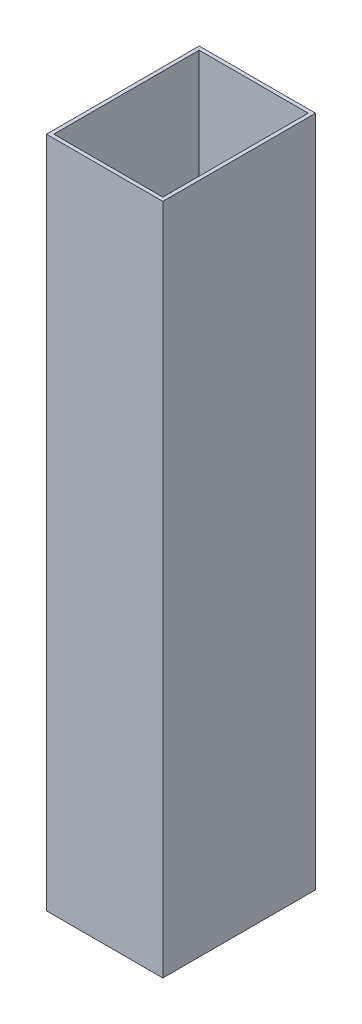
from build123d import *

# Parameters (mm, degrees)
SKETCH1_W           = 81.28
SKETCH1_H           = 106.68
SKETCH1_W_2         = 76.2
SKETCH1_H_2         = 101.6
EXTRUDE_THIN1_DEPTH = 469.9


with BuildPart() as part:
    # Sketch1 → Extrude-Thin1 (new body)
    with BuildSketch(Plane(origin=(0, 0, 0), x_dir=(1, 0, 0), z_dir=(0, 1, 0))):
        with Locations((10.707843137, -69.725490196)):
            Rectangle(SKETCH1_W, SKETCH1_H)
        with Locations((10.707843137, -69.725490196)):
            Rectangle(SKETCH1_W_2, SKETCH1_H_2, mode=Mode.SUBTRACT)
    extrude(amount=EXTRUDE_THIN1_DEPTH)


solid = part.part
